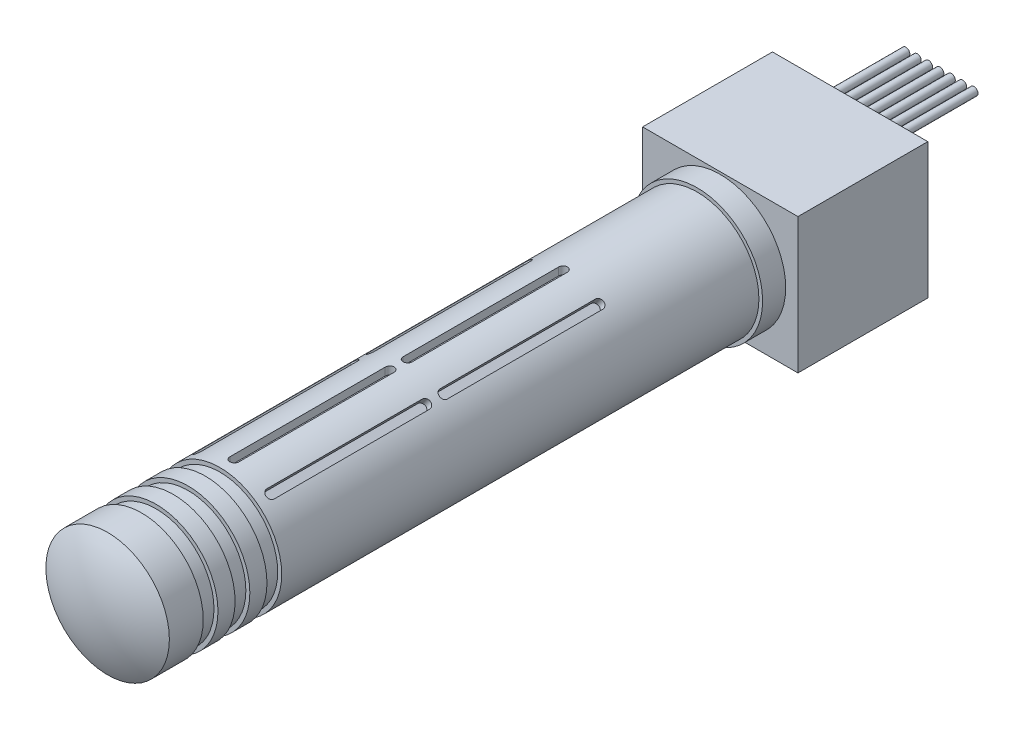
from build123d import *

# Parameters (mm, degrees)
SKETCH1_W           = 19.812
SKETCH1_H           = 17.272
BOSS_EXTRUDE1_DEPTH = 16.5608
SKETCH2_W           = 10.5156
SKETCH2_H           = 3.2766
BOSS_EXTRUDE2_DEPTH = 1.27
SKETCH3_R           = 8.3439
BOSS_EXTRUDE3_DEPTH = 2.9464
SKETCH4_R           = 7.874
BOSS_EXTRUDE4_DEPTH = 75.184
SKETCH6_R           = 0.508
WIRE_2_DEPTH        = 10.16
LPATTERN1_COUNT     = 7
LPATTERN1_PITCH     = 1.4478
CUT_EXTRUDE1_DEPTH  = 1.778
CIRPATTERN1_COUNT   = 10
CUT_EXTRUDE2_START  = -1.8796
SKETCH8_R           = 7.874
SKETCH8_R_2         = 7.366
CUT_EXTRUDE2_DEPTH  = 1.8796
LPATTERN2_COUNT     = 3
LPATTERN2_PITCH     = 4.064


with BuildPart() as part:
    # Sketch1 → Boss-Extrude1 (new body)
    with BuildSketch(Plane.XY):
        Rectangle(SKETCH1_W, SKETCH1_H)
    extrude(amount=BOSS_EXTRUDE1_DEPTH)

    # Sketch2 → Boss-Extrude2 (add)
    with BuildSketch(Plane(origin=(0, 0, 0), x_dir=(-1, 0, 0), z_dir=(0, 0, -1))):
        with Locations((0, 5.7277)):
            Rectangle(SKETCH2_W, SKETCH2_H)
    extrude(amount=BOSS_EXTRUDE2_DEPTH)

    # Sketch3 → Boss-Extrude3 (add)
    with BuildSketch(Plane.XY.offset(16.5608)):
        Circle(SKETCH3_R)
    extrude(amount=BOSS_EXTRUDE3_DEPTH)

    # Sketch4 → Boss-Extrude4 (add)
    with BuildSketch(Plane.XY.offset(19.5072)):
        Circle(SKETCH4_R)
    extrude(amount=BOSS_EXTRUDE4_DEPTH)

    # Sketch5 → Revolve1 (revolve)
    with BuildSketch(Plane(origin=(0, 0, 0), x_dir=(1, 0, 0), z_dir=(0, 1, 0))):
        with BuildLine():
            Line((0, -96.8502), (0, -94.6912))
            Line((0, -94.6912), (7.874, -94.6912))
            ThreePointArc((7.874, -94.6912), (4.082314203, -96.300669445), (0, -96.8502))
        make_face()
    revolve(axis=Axis((0, 0, 96.8502), (0, 0, -1)))

    # Sketch6 → Wire 2 (add)
    with BuildSketch(Plane(origin=(0, 0, -1.27), x_dir=(-1, 0, 0), z_dir=(0, 0, -1))):
        with Locations(Location((-4.3688, 5.7277, 0), (0, 0, 180))):
            Circle(SKETCH6_R)
    wire_2 = extrude(amount=WIRE_2_DEPTH)

    # LPattern1: Wire 2 ×7
    with Locations(*[(-i * LPATTERN1_PITCH, 0, 0) for i in range(1, LPATTERN1_COUNT)]):
        add(wire_2)

    # Sketch7 → Cut-Extrude1 (cut)
    with BuildSketch(Plane(origin=(0, 8.636, 0), x_dir=(1, 0, 0), z_dir=(0, 1, 0))):
        with BuildLine():
            Line((0.5715, -36.6268), (0.5715, -56.4388))
            ThreePointArc((0.5715, -56.4388), (0, -57.0103), (-0.5715, -56.4388))
            Line((-0.5715, -56.4388), (-0.5715, -36.6268))
            ThreePointArc((-0.5715, -36.6268), (0, -36.0553), (0.5715, -36.6268))
        make_face()
        with BuildLine():
            Line((0.5715, -58.7248), (0.5715, -78.5368))
            ThreePointArc((0.5715, -78.5368), (0, -79.1083), (-0.5715, -78.5368))
            Line((-0.5715, -78.5368), (-0.5715, -58.7248))
            ThreePointArc((-0.5715, -58.7248), (0, -58.1533), (0.5715, -58.7248))
        make_face()
    cut_extrude1 = extrude(amount=-CUT_EXTRUDE1_DEPTH, mode=Mode.SUBTRACT)

    # CirPattern1: Cut-Extrude1 ×10 about axis, 4 skipped
    cirpattern1_axis = Axis((0, 0, 0), (0, 0, -1))
    add([cut_extrude1.rotate(cirpattern1_axis, i * 360 / CIRPATTERN1_COUNT) for i in range(1, CIRPATTERN1_COUNT) if i not in (2, 3, 7, 8)], mode=Mode.SUBTRACT)

    # Sketch8 → Cut-Extrude2 (cut)
    with BuildSketch(Plane.XY.offset(82.2452).offset(CUT_EXTRUDE2_START)):
        Circle(SKETCH8_R)
        Circle(SKETCH8_R_2, mode=Mode.SUBTRACT)
    cut_extrude2 = extrude(amount=CUT_EXTRUDE2_DEPTH, mode=Mode.SUBTRACT)

    # LPattern2: Cut-Extrude2 ×3
    with Locations(*[(0, 0, i * LPATTERN2_PITCH) for i in range(1, LPATTERN2_COUNT)]):
        add(cut_extrude2, mode=Mode.SUBTRACT)


solid = part.part
